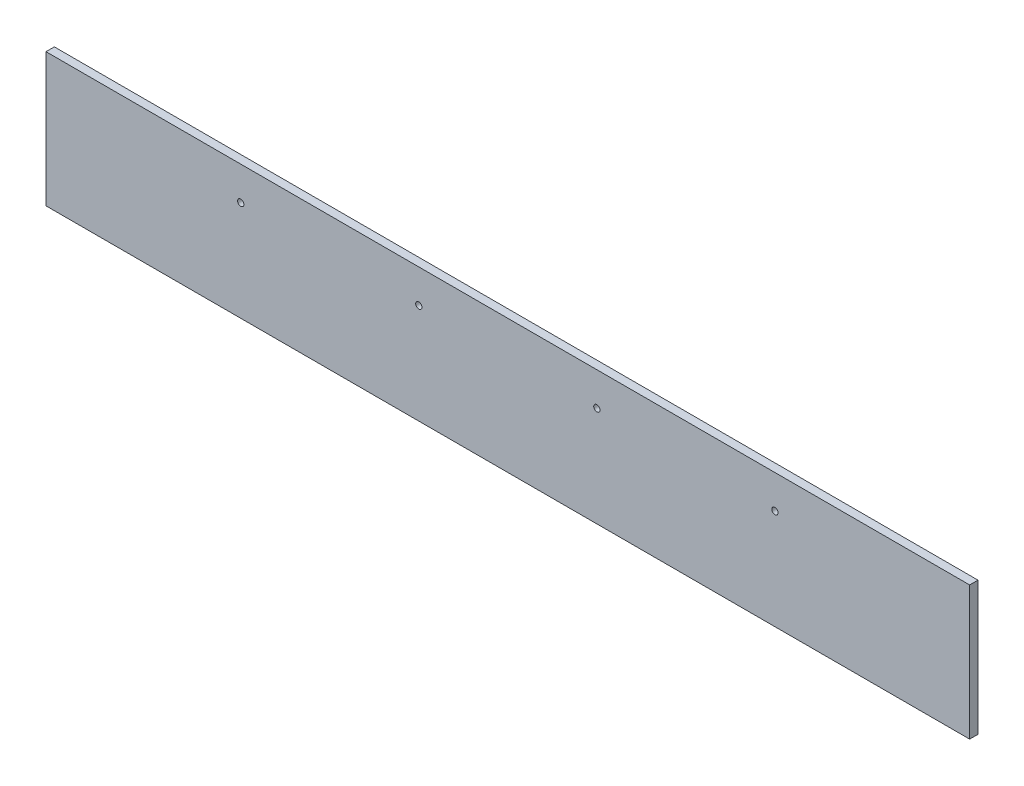
from build123d import *

# Parameters (mm, degrees)
SKETCH2_W                                           = 1073.15
SKETCH2_H                                           = 1073.15
BOSS_EXTRUDE2_DEPTH                                 = 152.4
SKETCH6_W                                           = 1054.1
SKETCH6_H                                           = 1054.1
CUT_EXTRUDE3_DEPTH                                  = 142.875
SKETCH7_W                                           = 768.35
SKETCH7_H                                           = 768.35
CUT_EXTRUDE4_DEPTH                                  = 142.875
SKETCH8_R                                           = 3.5687
CUT_EXTRUDE5_DEPTH                                  = 1270
SKETCH9_R                                           = 2.50063
CUT_EXTRUDE6_DEPTH                                  = 1270
CUT_EXTRUDE7_DEPTH                                  = 1016
CUT_EXTRUDE8_DEPTH                                  = 154.94
CUT_EXTRUDE8_DEPTH_BACK                             = 10.16
CSK_FOR_1_4_FLAT_HEAD_MACHINE_SCREW_100_D           = 6.7564
CSK_FOR_1_4_FLAT_HEAD_MACHINE_SCREW_100_CSINK_D     = 16.510254
CSK_FOR_1_4_FLAT_HEAD_MACHINE_SCREW_100_CSINK_ANGLE = 100
CSK_FOR_1_4_FLAT_HEAD_MACHINE_SCREW_2_D             = 6.7564
CSK_FOR_1_4_FLAT_HEAD_MACHINE_SCREW_2_CSINK_D       = 16.510254
CSK_FOR_1_4_FLAT_HEAD_MACHINE_SCREW_2_CSINK_ANGLE   = 100
CSK_FOR_1_4_FLAT_HEAD_MACHINE_SCREW_3_D             = 6.7564
CSK_FOR_1_4_FLAT_HEAD_MACHINE_SCREW_3_CSINK_D       = 16.510254
CSK_FOR_1_4_FLAT_HEAD_MACHINE_SCREW_3_CSINK_ANGLE   = 100
CSK_FOR_1_4_FLAT_HEAD_MACHINE_SCREW_4_D             = 6.7564
CSK_FOR_1_4_FLAT_HEAD_MACHINE_SCREW_4_CSINK_D       = 16.510254
CSK_FOR_1_4_FLAT_HEAD_MACHINE_SCREW_4_CSINK_ANGLE   = 100


with BuildPart() as part:
    # Sketch2 → Boss-Extrude2 (new body)
    with BuildSketch(Plane(origin=(0, 0, 0), x_dir=(1, 0, 0), z_dir=(0, 1, 0))):
        with Locations((-30.964668371, 76.000745145)):
            Rectangle(SKETCH2_W, SKETCH2_H)
    extrude(amount=BOSS_EXTRUDE2_DEPTH)

    # Sketch6 → Cut-Extrude3 (cut)
    with BuildSketch(Plane(origin=(0, 152.4, 0), x_dir=(1, 0, 0), z_dir=(0, 1, 0))):
        with Locations((-30.964668371, 76.000745145)):
            Rectangle(SKETCH6_W, SKETCH6_H)
    extrude(amount=-CUT_EXTRUDE3_DEPTH, mode=Mode.SUBTRACT)

    # Sketch7 → Cut-Extrude4 (cut)
    with BuildSketch(Plane(origin=(0, 9.525, 0), x_dir=(1, 0, 0), z_dir=(0, 1, 0))):
        with Locations((-30.964668371, 76.000745145)):
            Rectangle(SKETCH7_W, SKETCH7_H)
    extrude(amount=-CUT_EXTRUDE4_DEPTH, mode=Mode.SUBTRACT)

    # Sketch8 → Cut-Extrude5 (cut)
    with BuildSketch(Plane.XY.offset(460.574254855)):
        with Locations((273.835331629, 114.3)):
            Circle(SKETCH8_R)
        with Locations((70.635331629, 114.3)):
            Circle(SKETCH8_R)
        with Locations((-132.564668371, 114.3)):
            Circle(SKETCH8_R)
        with Locations((-335.764668371, 114.3)):
            Circle(SKETCH8_R)
    extrude(amount=-CUT_EXTRUDE5_DEPTH, mode=Mode.SUBTRACT)

    # Sketch9 → Cut-Extrude6 (cut)
    with BuildSketch(Plane.ZY.offset(567.539668371)):
        with Locations((295.474254855, 114.3)):
            Circle(SKETCH9_R)
        with Locations((146.884254855, 114.3)):
            Circle(SKETCH9_R)
        with Locations((-1.705745145, 114.3)):
            Circle(SKETCH9_R)
        with Locations((-150.295745145, 114.3)):
            Circle(SKETCH9_R)
        with Locations((-298.885745145, 114.3)):
            Circle(SKETCH9_R)
        with Locations((-447.475745145, 114.3)):
            Circle(SKETCH9_R)
    extrude(amount=-CUT_EXTRUDE6_DEPTH, mode=Mode.SUBTRACT)

    # Sketch10 → Cut-Extrude7 (cut)
    with BuildSketch(Plane.XZ):
        Polygon((-415.139668371, -460.175745145), (-415.139668371, 308.174254855), (-567.539668371, 460.574254855), (-567.539668371, -612.575745145), (505.610331629, -612.575745145), (505.610331629, 460.574254855), (353.210331629, 308.174254855), (353.210331629, -460.175745145), align=None)
    extrude(amount=-CUT_EXTRUDE7_DEPTH, mode=Mode.SUBTRACT)

    # Sketch11 → Cut-Extrude8 (cut, two sides: drawn at the far end of the back side and taken through both)
    with BuildSketch(Plane(origin=(0, 9.525, 0), x_dir=(1, 0, 0), z_dir=(0, 1, 0)).offset(-CUT_EXTRUDE8_DEPTH_BACK)):
        Polygon((-567.539668371, -460.574254855), (-558.014668371, -451.049254855), (-558.014668371, -460.574254855), align=None)
        Polygon((496.085331629, -451.049254855), (505.610331629, -460.574254855), (496.085331629, -460.574254855), align=None)
    extrude(amount=CUT_EXTRUDE8_DEPTH + CUT_EXTRUDE8_DEPTH_BACK, mode=Mode.SUBTRACT)

    # CSK for 1_4 Flat Head Machine Screw _100 (through all)
    with Locations(Plane(origin=(273.835331629, 114.3, 451.049254855), x_dir=(-1, 0, 0), z_dir=(0, 0, -1))):
        with Locations((0, 0)):
            CounterSinkHole(CSK_FOR_1_4_FLAT_HEAD_MACHINE_SCREW_100_D / 2, CSK_FOR_1_4_FLAT_HEAD_MACHINE_SCREW_100_CSINK_D / 2, counter_sink_angle=CSK_FOR_1_4_FLAT_HEAD_MACHINE_SCREW_100_CSINK_ANGLE)

    # CSK for 1_4 Flat Head Machine Screw  2 (through all)
    with Locations(Plane(origin=(70.635331629, 114.3, 451.049254855), x_dir=(-1, 0, 0), z_dir=(0, 0, -1))):
        with Locations((0, 0)):
            CounterSinkHole(CSK_FOR_1_4_FLAT_HEAD_MACHINE_SCREW_2_D / 2, CSK_FOR_1_4_FLAT_HEAD_MACHINE_SCREW_2_CSINK_D / 2, counter_sink_angle=CSK_FOR_1_4_FLAT_HEAD_MACHINE_SCREW_2_CSINK_ANGLE)

    # CSK for 1_4 Flat Head Machine Screw  3 (through all)
    with Locations(Plane(origin=(-132.564668371, 114.3, 451.049254855), x_dir=(-1, 0, 0), z_dir=(0, 0, -1))):
        with Locations((0, 0)):
            CounterSinkHole(CSK_FOR_1_4_FLAT_HEAD_MACHINE_SCREW_3_D / 2, CSK_FOR_1_4_FLAT_HEAD_MACHINE_SCREW_3_CSINK_D / 2, counter_sink_angle=CSK_FOR_1_4_FLAT_HEAD_MACHINE_SCREW_3_CSINK_ANGLE)

    # CSK for 1_4 Flat Head Machine Screw  4 (through all)
    with Locations(Plane(origin=(-335.764668371, 114.3, 451.049254855), x_dir=(-1, 0, 0), z_dir=(0, 0, -1))):
        with Locations((0, 0)):
            CounterSinkHole(CSK_FOR_1_4_FLAT_HEAD_MACHINE_SCREW_4_D / 2, CSK_FOR_1_4_FLAT_HEAD_MACHINE_SCREW_4_CSINK_D / 2, counter_sink_angle=CSK_FOR_1_4_FLAT_HEAD_MACHINE_SCREW_4_CSINK_ANGLE)


solid = part.part
